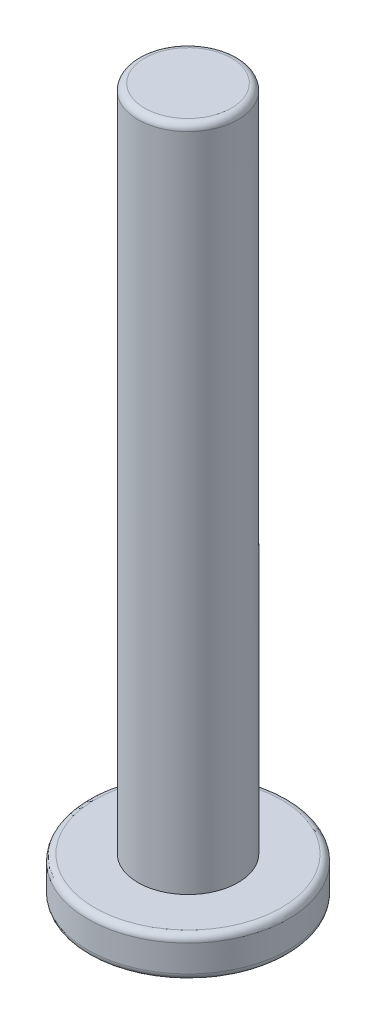
from build123d import *

# Parameters (mm, degrees)
FILLET1_R          = 0.2
CUT_EXTRUDE1_DEPTH = 1


with BuildPart() as part:
    # Sketch2 → Revolve1 (revolve)
    with BuildSketch(Plane.XY, mode=Mode.PRIVATE) as revolve1_sk:
        Polygon((0, 0), (3, 0), (3, 1.2), (1.5, 1.2), (1.5, 21.2), (0, 21.2), align=None)
    revolve(revolve1_sk.sketch.rotate(Axis((0, 73.114266362, 0), (0, -1, 0)), 90), axis=Axis((0, 73.114266362, 0), (0, -1, 0)))

    # Fillet1
    fillet1_edges = [part.edges().sort_by_distance(p)[0] for p in [
        (0, 21.2, -1.5),
        (0, 1.2, -3),
        (0, 0, -3),
    ]]
    fillet(fillet1_edges, radius=FILLET1_R)

    # Sketch3 → Cut-Extrude1 (cut)
    with BuildSketch(Plane.XZ):
        Polygon((1.443375673, 0), (0.721687836, 1.25), (-0.721687836, 1.25), (-1.443375673, 0), (-0.721687836, -1.25), (0.721687836, -1.25), align=None)
    extrude(amount=-CUT_EXTRUDE1_DEPTH, mode=Mode.SUBTRACT)


solid = part.part
